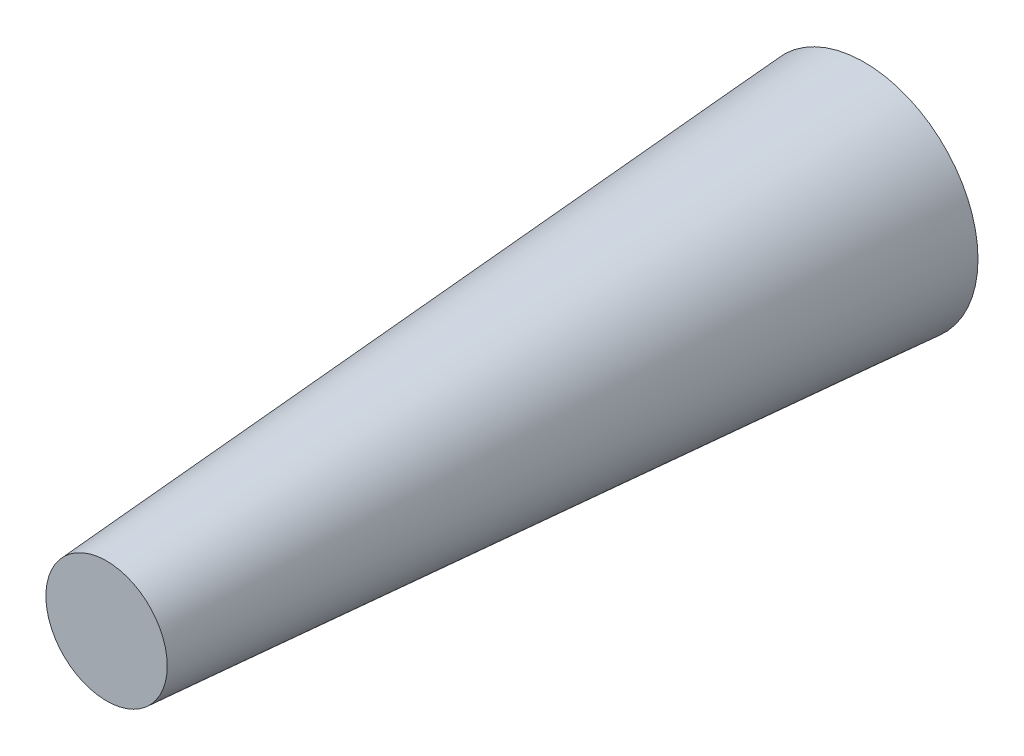
from build123d import *

# Parameters (mm, degrees)
SKETCH1_R           = 1.5
BOSS_EXTRUDE1_DEPTH = 10
BOSS_EXTRUDE1_TAPER = 4


with BuildPart() as part:
    # Sketch1 → Boss-Extrude1 (new body)
    with BuildSketch(Plane.XY):
        Circle(SKETCH1_R)
    extrude(amount=BOSS_EXTRUDE1_DEPTH, taper=BOSS_EXTRUDE1_TAPER)


solid = part.part
